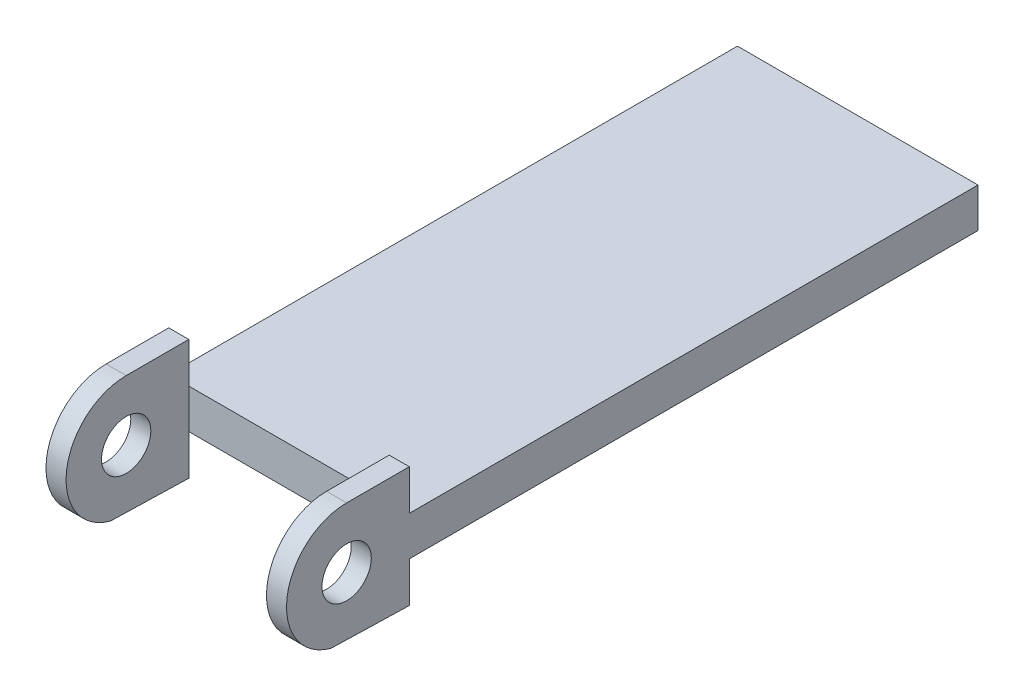
from build123d import *

# Parameters (mm, degrees)
SKETCH1_W               = 12.192
SKETCH1_H               = 30.734
BOSS_EXTRUDE1_DEPTH     = 2
BOSS_EXTRUDE2_DEPTH     = 12.192
SKETCH3_R               = 1.25
CUT_EXTRUDE1_DEPTH      = 24.505965051
CUT_EXTRUDE2_DEPTH      = 22.001112947
CUT_EXTRUDE2_DEPTH_BACK = 22.001112947
SKETCH4_W               = 10.16
SKETCH4_H               = 6.223


with BuildPart() as part:
    # Sketch1 → Boss-Extrude1 (new body)
    with BuildSketch(Plane(origin=(0, 0, 0), x_dir=(1, 0, 0), z_dir=(0, 1, 0))):
        Rectangle(SKETCH1_W, SKETCH1_H)
    extrude(amount=BOSS_EXTRUDE1_DEPTH)

    # Sketch2 → Boss-Extrude2 (add)
    with BuildSketch(Plane(origin=(6.096, 0, 0), x_dir=(0, 0, -1), z_dir=(1, 0, 0))):
        with BuildLine():
            ThreePointArc((-13.757711199, 0), (-14.618095322, -1.28349029), (-15.997337956, -1.980123566))
            Line((-15.997337956, -1.980123566), (-13.462, -2.048))
            Line((-13.462, -2.048), (-13.462, 0))
            Line((-13.462, 0), (-13.757711199, 0))
        make_face()
        with BuildLine():
            Line((-13.462, 2), (-13.757711199, 2))
            ThreePointArc((-13.757711199, 2), (-13.631473734, 1.50706594), (-13.589, 1))
            ThreePointArc((-13.589, 1), (-13.631473734, 0.49293406), (-13.757711199, 0))
            Line((-13.757711199, 0), (-13.462, 0))
            Line((-13.462, 0), (-13.462, 2))
        make_face()
        with BuildLine():
            Line((-13.462, 4.048), (-16.637, 4.048))
            ThreePointArc((-16.637, 4.048), (-14.870321761, 3.483777768), (-13.757711199, 2))
            Line((-13.757711199, 2), (-13.462, 2))
            Line((-13.462, 2), (-13.462, 4.048))
        make_face()
        with BuildLine():
            ThreePointArc((-13.757711199, 2), (-14.870321761, 3.483777768), (-16.637, 4.048))
            ThreePointArc((-16.637, 4.048), (-19.658290199, 1.402628284), (-17.435200057, -1.941628914))
            Line((-17.435200057, -1.941628914), (-15.997337956, -1.980123566))
            ThreePointArc((-15.997337956, -1.980123566), (-14.618095322, -1.28349029), (-13.757711199, 0))
            Line((-13.757711199, 0), (-15.367, 0))
            Line((-15.367, 0), (-15.367, 2))
            Line((-15.367, 2), (-13.757711199, 2))
        make_face()
    extrude(amount=-BOSS_EXTRUDE2_DEPTH)

    # Sketch3 → Cut-Extrude1 (cut, through all)
    with BuildSketch(Plane(origin=(6.096, 0, 0), x_dir=(0, 0, -1), z_dir=(1, 0, 0))):
        with Locations((-16.637, 1)):
            Circle(SKETCH3_R)
    extrude(amount=-CUT_EXTRUDE1_DEPTH, mode=Mode.SUBTRACT)

    # Sketch4 → Cut-Extrude2 (cut, two sides: drawn at the far end of the back side and taken through both)
    with BuildSketch(Plane(origin=(0, 2, 0), x_dir=(1, 0, 0), z_dir=(0, 1, 0)).offset(-CUT_EXTRUDE2_DEPTH_BACK)):
        with Locations((0, -16.5735)):
            Rectangle(SKETCH4_W, SKETCH4_H)
    extrude(amount=CUT_EXTRUDE2_DEPTH + CUT_EXTRUDE2_DEPTH_BACK, mode=Mode.SUBTRACT)


solid = part.part
